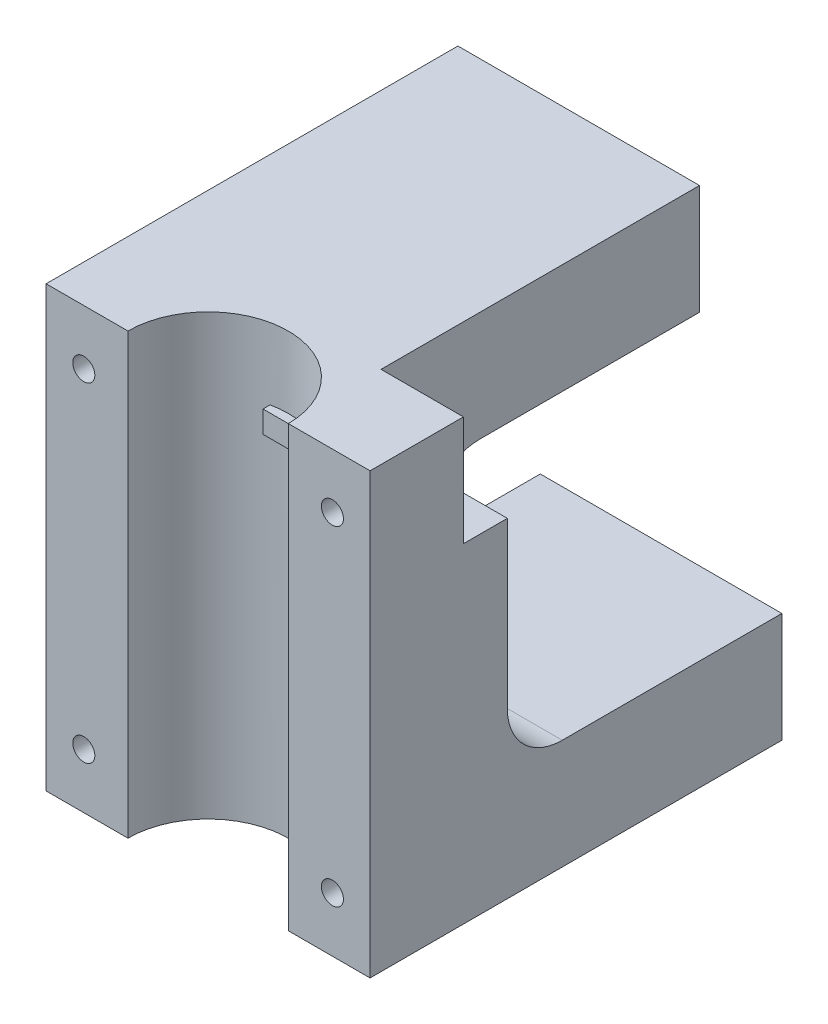
from build123d import *

# Parameters (mm, degrees)
SKETCH1_W                   = 74.93
SKETCH1_H                   = 101.6
BOSS_EXTRUDE2_DEPTH         = 95.25
CUT_EXTRUDE2_DEPTH          = 145.217712938
CUT_EXTRUDE2_DEPTH_BACK     = 145.217712938
SKETCH4_W                   = 7.62
SKETCH4_H                   = 78.74
BOSS_EXTRUDE3_DEPTH         = 2.54
TAP_DRILL_FOR_1_4_20_TAP1_D = 5.1054
SKETCH9_W                   = 19.05
SKETCH9_H                   = 25.4
CUT_EXTRUDE3_DEPTH          = 73.66
SKETCH10_W                  = 74.93
SKETCH10_H                  = 50.8
CUT_EXTRUDE4_DEPTH          = 63.5
FILLET1_R                   = 12.7


with BuildPart() as part:
    # Sketch1 → Boss-Extrude2 (new body)
    with BuildSketch(Plane.XY):
        Rectangle(SKETCH1_W, SKETCH1_H)
    extrude(amount=-BOSS_EXTRUDE2_DEPTH)

    # Sketch2 → Cut-Extrude2 (cut, two sides: drawn at the far end of the back side and taken through both)
    with BuildSketch(Plane(origin=(0, 50.8, 0), x_dir=(1, 0, 0), z_dir=(0, 1, 0)).offset(-CUT_EXTRUDE2_DEPTH_BACK)):
        with BuildLine():
            Line((-18.542, -230.991823822), (-18.542, 0))
            ThreePointArc((-18.542, 0), (0, 18.542), (18.542, 0))
            Line((18.542, 0), (18.542, -230.991823822))
            Line((18.542, -230.991823822), (18.542, -692.975471465))
            Line((18.542, -692.975471465), (-18.542, -692.975471465))
            Line((-18.542, -692.975471465), (-18.542, -230.991823822))
        make_face()
    extrude(amount=CUT_EXTRUDE2_DEPTH + CUT_EXTRUDE2_DEPTH_BACK, mode=Mode.SUBTRACT)

    # Sketch4 → Boss-Extrude3 (add, symmetric)
    with BuildSketch(Plane(origin=(0, 31.75, 0), x_dir=(1, 0, 0), z_dir=(0, 1, 0))):
        with Locations((0, 55.88)):
            Rectangle(SKETCH4_W, SKETCH4_H)
    extrude(amount=BOSS_EXTRUDE3_DEPTH, both=True)

    # Tap Drill for 1/4-20 Tap1 (through all)
    with Locations(Plane.XY):
        with Locations((-28.7528, 38.1), (28.7528, 38.1), (-28.7528, -38.1), (28.7528, -38.1)):
            Hole(TAP_DRILL_FOR_1_4_20_TAP1_D / 2)

    # Sketch9 → Cut-Extrude3 (cut)
    with BuildSketch(Plane(origin=(0, 0, -95.25), x_dir=(-1, 0, 0), z_dir=(0, 0, -1))):
        with Locations((-27.94, 38.1)):
            Rectangle(SKETCH9_W, SKETCH9_H)
        with Locations((27.94, -38.1)):
            Rectangle(SKETCH9_W, SKETCH9_H)
    extrude(amount=-CUT_EXTRUDE3_DEPTH, mode=Mode.SUBTRACT)

    # Sketch10 → Cut-Extrude4 (cut)
    with BuildSketch(Plane(origin=(0, 0, -95.25), x_dir=(-1, 0, 0), z_dir=(0, 0, -1))):
        Rectangle(SKETCH10_W, SKETCH10_H)
    extrude(amount=-CUT_EXTRUDE4_DEPTH, mode=Mode.SUBTRACT)

    # Fillet1
    fillet1_edges = [part.edges().sort_by_distance(p)[0] for p in [
        (-9.525, 25.4, -31.75),
        (9.525, -25.4, -31.75),
    ]]
    fillet(fillet1_edges, radius=FILLET1_R)


solid = part.part
